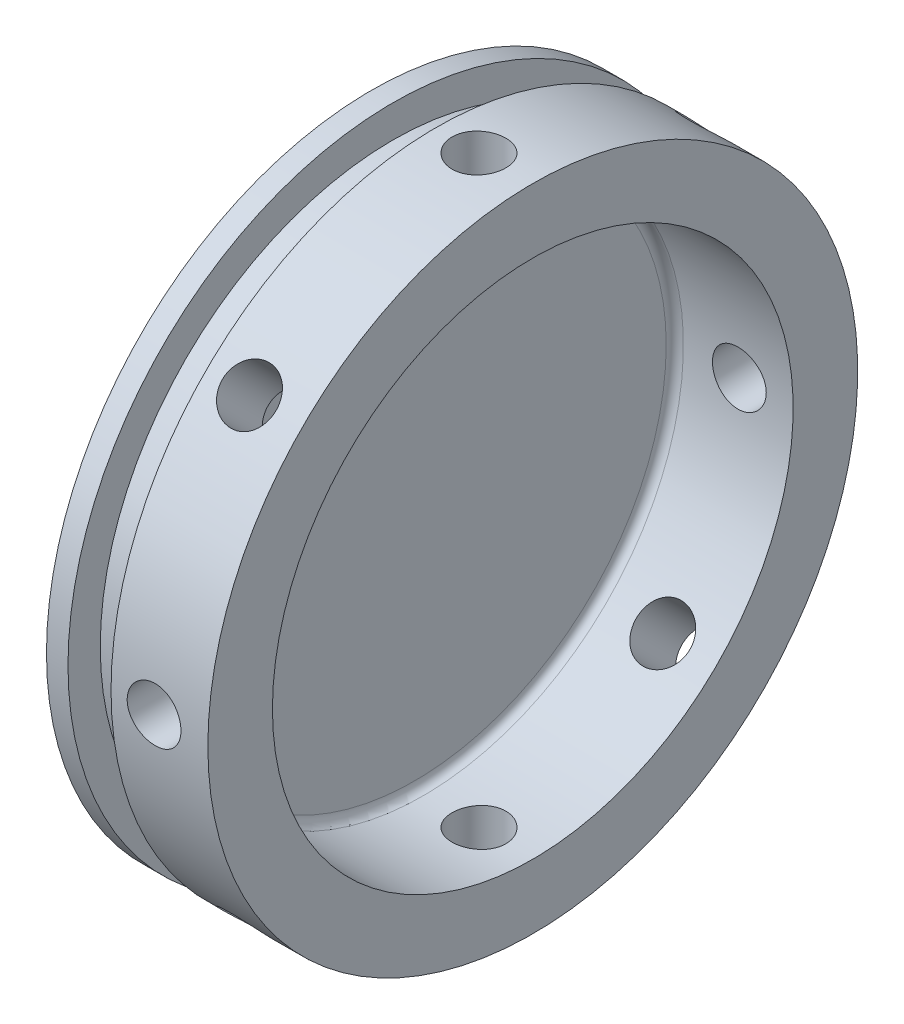
from build123d import *

# Parameters (mm, degrees)
SKETCH2_R          = 2.5
CUT_EXTRUDE1_DEPTH = 100
CIRPATTERN1_COUNT  = 8
FILLET1_R          = 0.8


with BuildPart() as part:
    # Sketch1 → Revolve1 (revolve)
    with BuildSketch(Plane(origin=(0, 0, 0), x_dir=(1, 0, 0), z_dir=(0, 1, 0)), mode=Mode.PRIVATE) as revolve1_sk:
        Polygon((0, 0), (0, 30.2), (2, 30.2), (2, 27.2), (6, 27.2), (6, 30.2), (15, 30.2), (15, 24.2), (4, 24.2), (4, 0), align=None)
    revolve(revolve1_sk.sketch.rotate(Axis((0, 0, 0), (1, 0, 0)), 180), axis=Axis((0, 0, 0), (1, 0, 0)))

    # Sketch2 → Cut-Extrude1 (cut)
    with BuildSketch(Plane(origin=(0, 0, 0), x_dir=(1, 0, 0), z_dir=(0, 1, 0))):
        with Locations(Location((10, 0, 0), (0, 0, 270))):
            Circle(SKETCH2_R)
    cut_extrude1 = extrude(amount=-CUT_EXTRUDE1_DEPTH, mode=Mode.SUBTRACT)

    # CirPattern1: Cut-Extrude1 ×8 about axis
    cirpattern1_axis = Axis((4, 0, 0), (1, 0, 0))
    for i in range(1, CIRPATTERN1_COUNT):
        add(cut_extrude1.rotate(cirpattern1_axis, i * 360 / CIRPATTERN1_COUNT), mode=Mode.SUBTRACT)

    # Fillet1
    fillet1_edges = [part.edges().sort_by_distance(p)[0] for p in [
        (4, 0, -24.2),
    ]]
    fillet(fillet1_edges, radius=FILLET1_R)


solid = part.part
